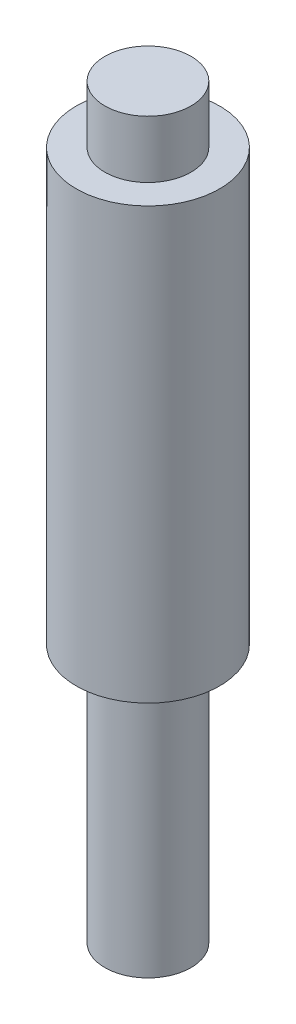
from build123d import *


with BuildPart() as part:
    # Sketch1 → Revolve1 (revolve)
    with BuildSketch(Plane.XY):
        Polygon((0, -11.660094277), (0, -37.660094277), (-1.5, -37.660094277), (-1.5, -28.660094277), (-2.5, -28.660094277), (-2.5, -13.660094277), (-1.5, -13.660094277), (-1.5, -11.660094277), align=None)
    revolve(axis=Axis((0, -11.660094277, 0), (0, -1, 0)))


solid = part.part
